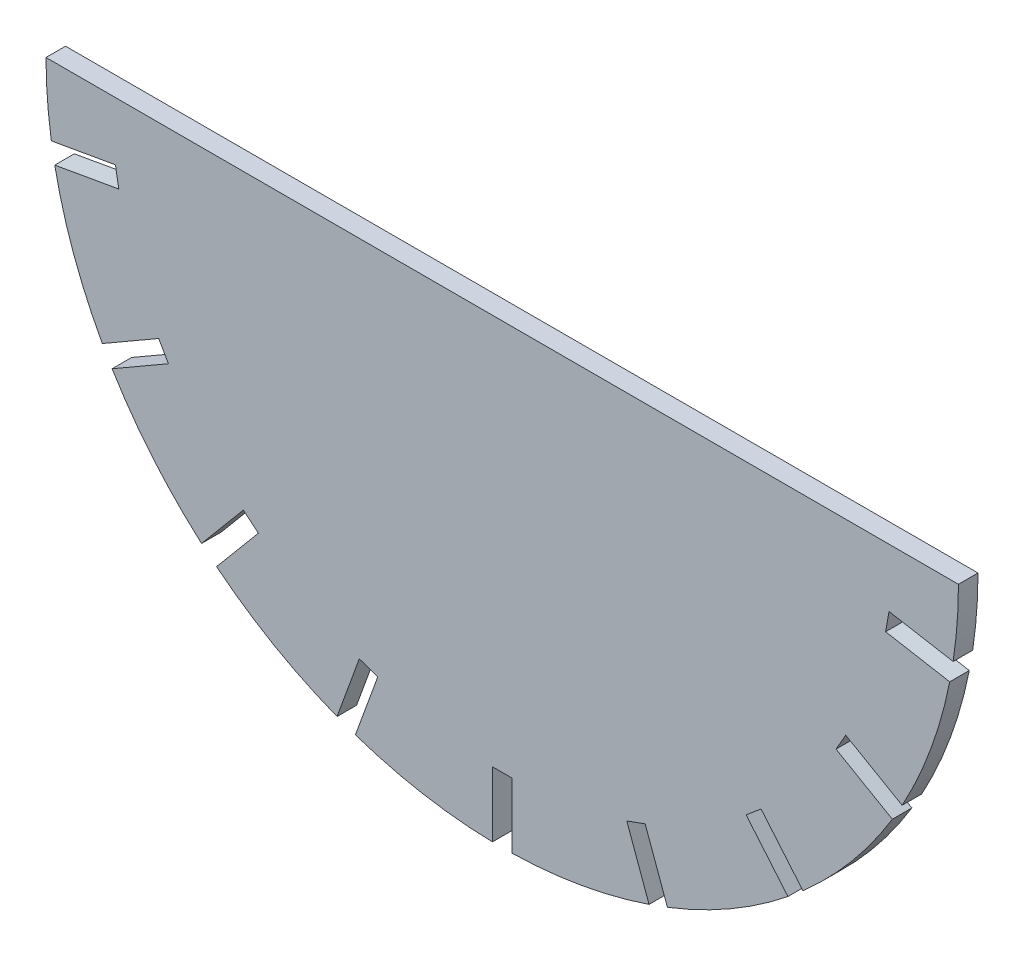
from build123d import *

# Parameters (mm, degrees)
BOSS_EXTRUDE1_DEPTH             = 3
SKETCH5_W                       = 3
SKETCH5_H                       = 10
CUT_EXTRUDE2_DEPTH              = 100.040395799
CIRPATTERN1_COUNT               = 5
CIRPATTERN1_ANGLE               = 80
CIRPATTERN1_THE_OTHER_WAY_COUNT = 5
CIRPATTERN1_THE_OTHER_WAY_ANGLE = 80


with BuildPart() as part:
    # Sketch4 → Boss-Extrude1 (new body)
    with BuildSketch(Plane.XY):
        with BuildLine():
            Line((70, 0), (-70, 0))
            ThreePointArc((-70, 0), (0, -70), (70, 0))
        make_face()
    extrude(amount=BOSS_EXTRUDE1_DEPTH)

    # Sketch5 → Cut-Extrude2 (cut, through all)
    with BuildSketch(Plane.XY):
        with Locations((0, -65)):
            Rectangle(SKETCH5_W, SKETCH5_H)
    cut_extrude2 = extrude(amount=CUT_EXTRUDE2_DEPTH, mode=Mode.SUBTRACT)

    # CirPattern1: Cut-Extrude2 ×5 about axis
    cirpattern1_axis = Axis((0, 0, 3), (0, 0, -1))
    for i in range(1, CIRPATTERN1_COUNT):
        add(cut_extrude2.rotate(cirpattern1_axis, i * CIRPATTERN1_ANGLE / (CIRPATTERN1_COUNT - 1)), mode=Mode.SUBTRACT)

    # CirPattern1 the other way: Cut-Extrude2 ×5 about axis
    cirpattern1_the_other_way_axis = Axis((0, 0, 3), (0, 0, 1))
    for i in range(1, CIRPATTERN1_THE_OTHER_WAY_COUNT):
        add(cut_extrude2.rotate(cirpattern1_the_other_way_axis, i * CIRPATTERN1_THE_OTHER_WAY_ANGLE / (CIRPATTERN1_THE_OTHER_WAY_COUNT - 1)), mode=Mode.SUBTRACT)


solid = part.part
